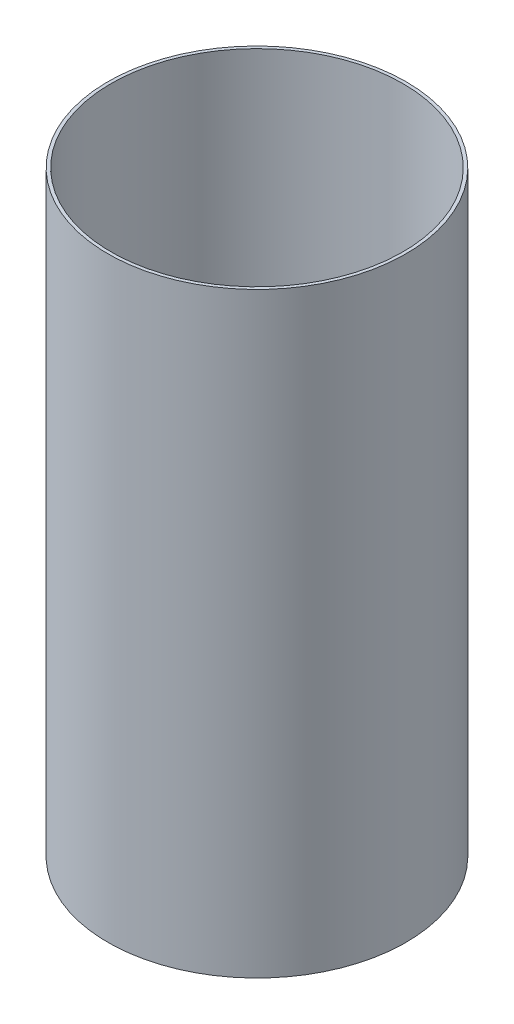
from build123d import *

# Parameters (mm, degrees)
SKETCH1_R           = 78.35
SKETCH1_R_2         = 76.67
BOSS_EXTRUDE1_DEPTH = 313.4


with BuildPart() as part:
    # Sketch1 → Boss-Extrude1 (new body)
    with BuildSketch(Plane(origin=(0, 0, 0), x_dir=(1, 0, 0), z_dir=(0, 1, 0))):
        with Locations(Location((0, 0, 0), (0, 0, 90))):
            Circle(SKETCH1_R)
        with Locations(Location((0, 0, 0), (0, 0, 90))):
            Circle(SKETCH1_R_2, mode=Mode.SUBTRACT)
    extrude(amount=BOSS_EXTRUDE1_DEPTH)


solid = part.part
